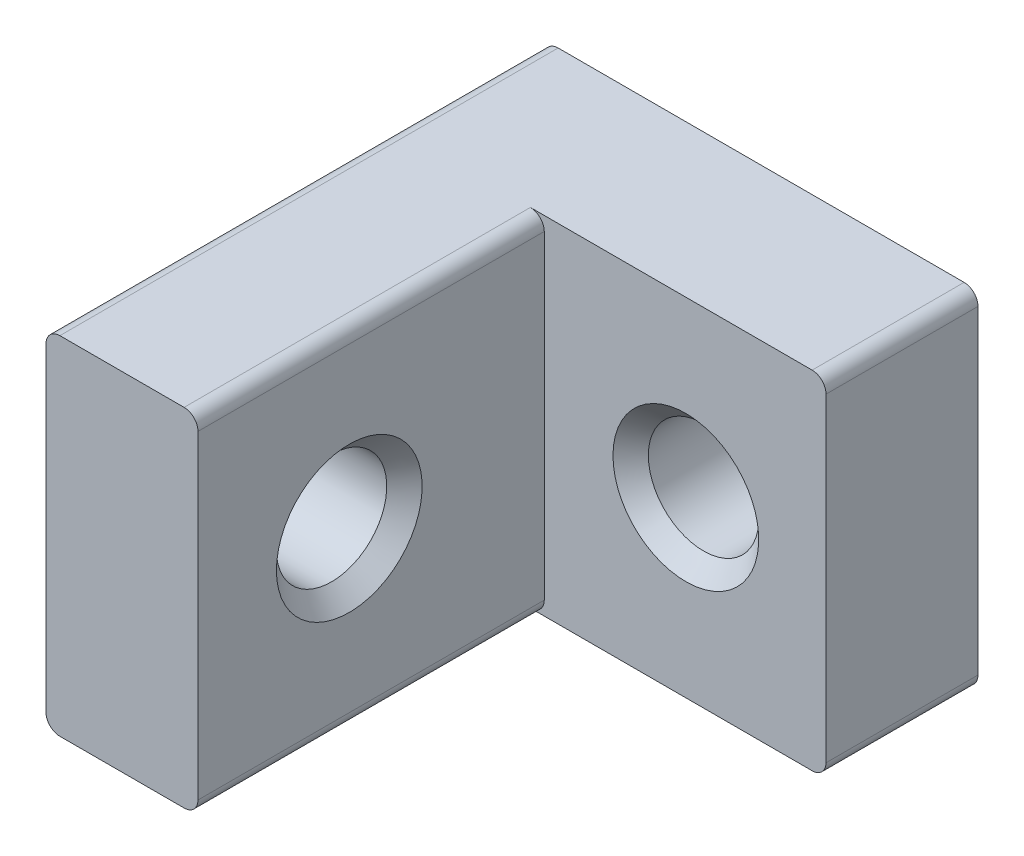
from build123d import *

# Parameters (mm, degrees)
EXTRUDE1_DEPTH = 6.35
FILLET1_R      = 0.508


with BuildPart() as part:
    # Sketch1 → Extrude1 (new, symmetric)
    with BuildSketch(Plane(origin=(0, 0, 0), x_dir=(1, 0, 0), z_dir=(0, 1, 0))):
        Polygon((5.9436, -18.2372), (5.9436, -5.5626), (16.256, -5.5626), (16.256, 0), (0.381, 0), (0.381, -18.2372), align=None)
    extrude(amount=EXTRUDE1_DEPTH, both=True)

    # Sketch2 → #10-32 Tapped Hole2 (revolve, cut)
    with BuildSketch(Plane(origin=(0.381, 0, 12.7), x_dir=(0, 0, 1), z_dir=(0, 1, 0))):
        Polygon((0, 0), (0, 5.5626), (2.667, 5.5626), (2.0193, 4.9149), (2.0193, 0.6477), (2.667, 0), align=None)
    revolve(axis=Axis((-5.969, 0, 12.7), (1, 0, 0)), mode=Mode.SUBTRACT)

    # Sketch4 → #10-32 Tapped Hole1 (revolve, cut)
    with BuildSketch(Plane.YZ.offset(11.1252)):
        Polygon((0, 0), (0, 5.5626), (2.667, 5.5626), (2.0193, 4.9149), (2.0193, 0.6477), (2.667, 0), align=None)
    revolve(axis=Axis((11.1252, 0, -6.35), (0, 0, 1)), mode=Mode.SUBTRACT)

    # Fillet1
    fillet1_edges = [part.edges().sort_by_distance(p)[0] for p in [
        (5.9436, 6.35, 11.8999),
        (16.256, 6.35, 2.7813),
        (0.381, 6.35, 9.1186),
        (16.256, -6.35, 2.7813),
        (5.9436, -6.35, 11.8999),
        (0.381, -6.35, 9.1186),
    ]]
    fillet(fillet1_edges, radius=FILLET1_R)


solid = part.part
